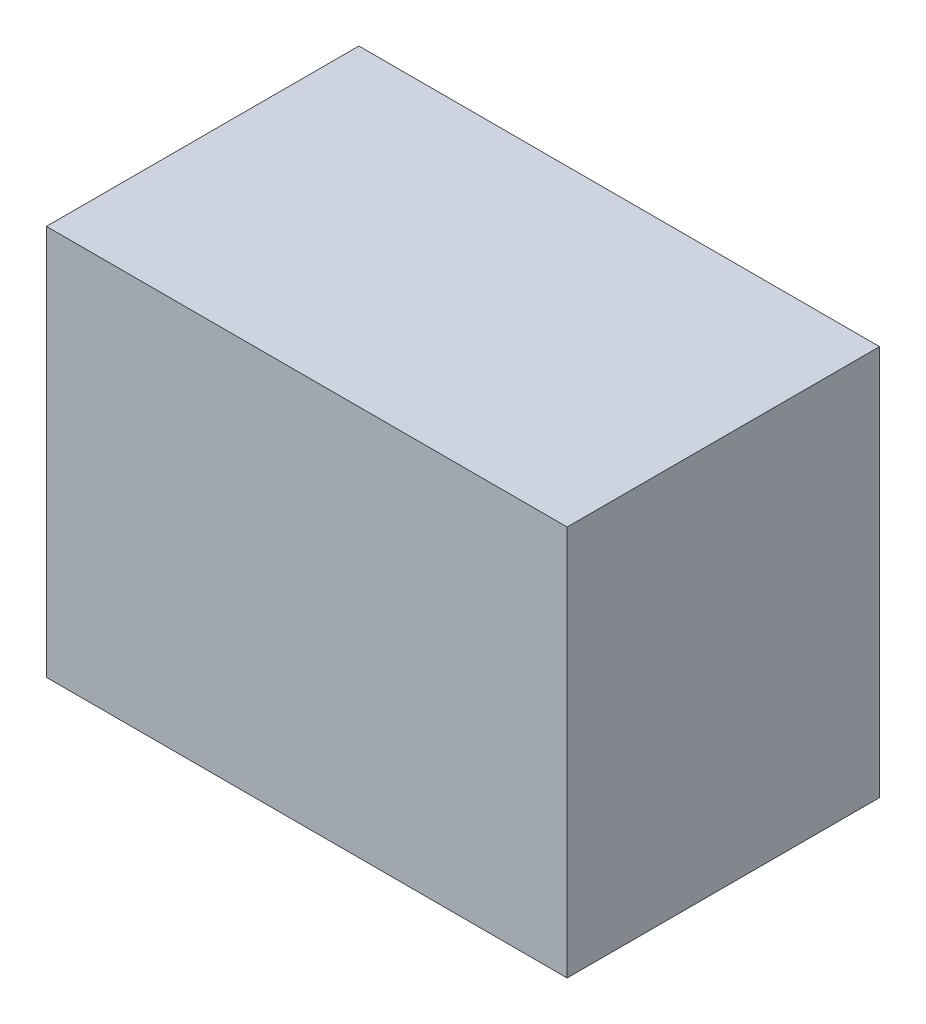
from build123d import *

# Parameters (mm, degrees)
ESQUISSE1_W             = 20
ESQUISSE1_H             = 15
BOSS_EXTRU_1_DEPTH      = 12
ESQUISSE2_W             = 18
ESQUISSE2_H             = 10
ENL_V_MAT_EXTRU_1_DEPTH = 12


with BuildPart() as part:
    # Esquisse1 → Boss.-Extru.1 (new body)
    with BuildSketch(Plane.XY):
        with Locations((10, 7.5)):
            Rectangle(ESQUISSE1_W, ESQUISSE1_H)
    extrude(amount=BOSS_EXTRU_1_DEPTH)

    # Esquisse2 → Enlèv. mat.-Extru.1 (cut)
    with BuildSketch(Plane.XZ):
        with Locations((10, 6)):
            Rectangle(ESQUISSE2_W, ESQUISSE2_H)
    extrude(amount=-ENL_V_MAT_EXTRU_1_DEPTH, mode=Mode.SUBTRACT)


solid = part.part
